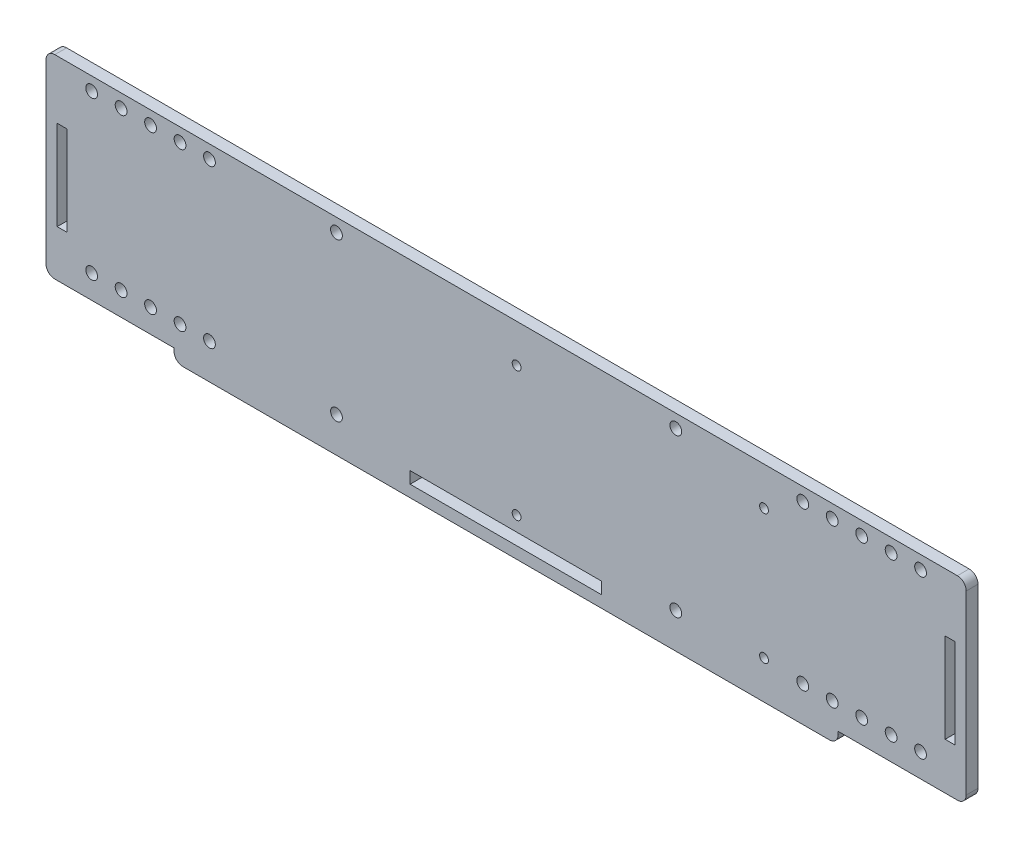
from build123d import *

# Parameters (mm, degrees)
SKETCH1_R           = 2
SKETCH1_R_2         = 1.5
SKETCH1_W           = 3.35
SKETCH1_H           = 30.4
SKETCH1_W_2         = 65
SKETCH1_H_2         = 4
BOSS_EXTRUDE1_DEPTH = 4
FILLET1_R           = 3


with BuildPart() as part:
    # Sketch1 → Boss-Extrude1 (new body)
    with BuildSketch(Plane.XY):
        Polygon((-156.215, 33), (156.215, 33), (156.215, -33), (112.73, -33), (112.73, -37), (-112.73, -37), (-112.73, -33), (-156.215, -33), align=None)
        with Locations((-140.715, 28.5)):
            Circle(SKETCH1_R, mode=Mode.SUBTRACT)
        with Locations((-130.715, 28.5)):
            Circle(SKETCH1_R, mode=Mode.SUBTRACT)
        with Locations((-120.715, 28.5)):
            Circle(SKETCH1_R, mode=Mode.SUBTRACT)
        with Locations((-110.715, 28.5)):
            Circle(SKETCH1_R, mode=Mode.SUBTRACT)
        with Locations((-100.715, 28.5)):
            Circle(SKETCH1_R, mode=Mode.SUBTRACT)
        with Locations((-57.595, 28.5)):
            Circle(SKETCH1_R, mode=Mode.SUBTRACT)
        with Locations(Location((57.595, 28.5, 0), (0, 0, 180))):
            Circle(SKETCH1_R, mode=Mode.SUBTRACT)
        with Locations(Location((100.715, 28.5, 0), (0, 0, 180))):
            Circle(SKETCH1_R, mode=Mode.SUBTRACT)
        with Locations(Location((110.715, 28.5, 0), (0, 0, 180))):
            Circle(SKETCH1_R, mode=Mode.SUBTRACT)
        with Locations(Location((120.715, 28.5, 0), (0, 0, 180))):
            Circle(SKETCH1_R, mode=Mode.SUBTRACT)
        with Locations(Location((130.715, 28.5, 0), (0, 0, 180))):
            Circle(SKETCH1_R, mode=Mode.SUBTRACT)
        with Locations(Location((140.715, 28.5, 0), (0, 0, 180))):
            Circle(SKETCH1_R, mode=Mode.SUBTRACT)
        with Locations((-140.715, -25)):
            Circle(SKETCH1_R, mode=Mode.SUBTRACT)
        with Locations((-130.715, -25)):
            Circle(SKETCH1_R, mode=Mode.SUBTRACT)
        with Locations((-120.715, -25)):
            Circle(SKETCH1_R, mode=Mode.SUBTRACT)
        with Locations((-110.715, -25)):
            Circle(SKETCH1_R, mode=Mode.SUBTRACT)
        with Locations((-100.715, -25)):
            Circle(SKETCH1_R, mode=Mode.SUBTRACT)
        with Locations((-57.595, -25)):
            Circle(SKETCH1_R, mode=Mode.SUBTRACT)
        with Locations(Location((140.715, -25, 0), (0, 0, 180))):
            Circle(SKETCH1_R, mode=Mode.SUBTRACT)
        with Locations(Location((130.715, -25, 0), (0, 0, 180))):
            Circle(SKETCH1_R, mode=Mode.SUBTRACT)
        with Locations(Location((120.715, -25, 0), (0, 0, 180))):
            Circle(SKETCH1_R, mode=Mode.SUBTRACT)
        with Locations(Location((110.715, -25, 0), (0, 0, 180))):
            Circle(SKETCH1_R, mode=Mode.SUBTRACT)
        with Locations(Location((100.715, -25, 0), (0, 0, 180))):
            Circle(SKETCH1_R, mode=Mode.SUBTRACT)
        with Locations(Location((57.595, -25, 0), (0, 0, 180))):
            Circle(SKETCH1_R, mode=Mode.SUBTRACT)
        with Locations((3.565, -24)):
            Circle(SKETCH1_R_2, mode=Mode.SUBTRACT)
        with Locations((3.565, 20)):
            Circle(SKETCH1_R_2, mode=Mode.SUBTRACT)
        with Locations((87.565, 20)):
            Circle(SKETCH1_R_2, mode=Mode.SUBTRACT)
        with Locations((87.565, -24)):
            Circle(SKETCH1_R_2, mode=Mode.SUBTRACT)
        with Locations((150.74, -1.98)):
            Rectangle(SKETCH1_W, SKETCH1_H, mode=Mode.SUBTRACT)
        with Locations((-150.74, -1.98)):
            Rectangle(SKETCH1_W, SKETCH1_H, mode=Mode.SUBTRACT)
        with Locations((-0.085, -31)):
            Rectangle(SKETCH1_W_2, SKETCH1_H_2, mode=Mode.SUBTRACT)
    extrude(amount=BOSS_EXTRUDE1_DEPTH)

    # Fillet1
    fillet1_edges = [part.edges().sort_by_distance(p)[0] for p in [
        (112.73, -37, 2),
        (-112.73, -37, 2),
        (-156.215, -33, 2),
        (-156.215, 33, 2),
        (156.215, 33, 2),
        (156.215, -33, 2),
    ]]
    fillet(fillet1_edges, radius=FILLET1_R)


solid = part.part
